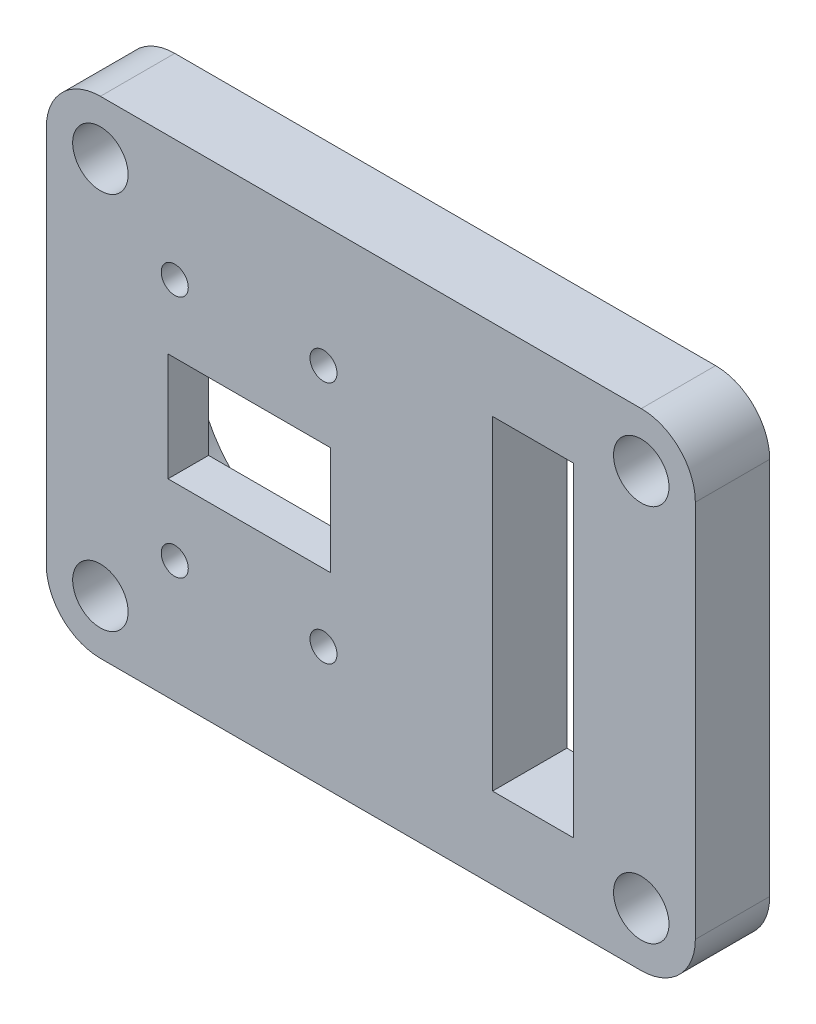
from build123d import *

# Parameters (mm, degrees)
SKETCH1_R           = 2.05
BOSS_EXTRUDE1_DEPTH = 2.75
SKETCH2_R           = 9.5
CUT_EXTRUDE1_DEPTH  = 2.5
SKETCH3_W           = 12
SKETCH3_H           = 8
CUT_EXTRUDE2_DEPTH  = 31.149626863
SKETCH4_R           = 1
CUT_EXTRUDE3_DEPTH  = 31.5
SKETCH5_W           = 6
SKETCH5_H           = 24
CUT_EXTRUDE4_DEPTH  = 31.5


with BuildPart() as part:
    # Sketch1 → Boss-Extrude1 (new, symmetric)
    with BuildSketch(Plane.XY):
        with BuildLine():
            Line((-20, -18), (20, -18))
            ThreePointArc((20, -18), (22.828427125, -16.828427125), (24, -14))
            Line((24, -14), (24, 14))
            ThreePointArc((24, 14), (22.828427125, 16.828427125), (20, 18))
            Line((20, 18), (-20, 18))
            ThreePointArc((-20, 18), (-22.828427125, 16.828427125), (-24, 14))
            Line((-24, 14), (-24, -14))
            ThreePointArc((-24, -14), (-22.828427125, -16.828427125), (-20, -18))
        make_face()
        with Locations((-20, -14)):
            Circle(SKETCH1_R, mode=Mode.SUBTRACT)
        with Locations((-20, 14)):
            Circle(SKETCH1_R, mode=Mode.SUBTRACT)
        with Locations((20, 14)):
            Circle(SKETCH1_R, mode=Mode.SUBTRACT)
        with Locations((20, -14)):
            Circle(SKETCH1_R, mode=Mode.SUBTRACT)
    extrude(amount=BOSS_EXTRUDE1_DEPTH, both=True)

    # Sketch2 → Cut-Extrude1 (cut)
    with BuildSketch(Plane.XY.offset(-2.75)):
        with Locations((-9, 0)):
            Circle(SKETCH2_R)
    extrude(amount=CUT_EXTRUDE1_DEPTH, mode=Mode.SUBTRACT)

    # Sketch3 → Cut-Extrude2 (cut, through all)
    with BuildSketch(Plane(origin=(0, 0, -0.25), x_dir=(1, 0, 0), z_dir=(0, 0, -1))):
        with Locations((-9, 0)):
            Rectangle(SKETCH3_W, SKETCH3_H)
    extrude(amount=-CUT_EXTRUDE2_DEPTH, mode=Mode.SUBTRACT)

    # Sketch4 → Cut-Extrude3 (cut, through all)
    with BuildSketch(Plane.XY.offset(2.75)):
        with Locations((-14.5, 9)):
            Circle(SKETCH4_R)
        with Locations((-3.5, 9)):
            Circle(SKETCH4_R)
        with Locations((-3.5, -9)):
            Circle(SKETCH4_R)
        with Locations((-14.5, -9)):
            Circle(SKETCH4_R)
    extrude(amount=-CUT_EXTRUDE3_DEPTH, mode=Mode.SUBTRACT)

    # Sketch5 → Cut-Extrude4 (cut, through all)
    with BuildSketch(Plane.XY.offset(2.75)):
        with Locations((12, 0)):
            Rectangle(SKETCH5_W, SKETCH5_H)
    extrude(amount=-CUT_EXTRUDE4_DEPTH, mode=Mode.SUBTRACT)


solid = part.part
